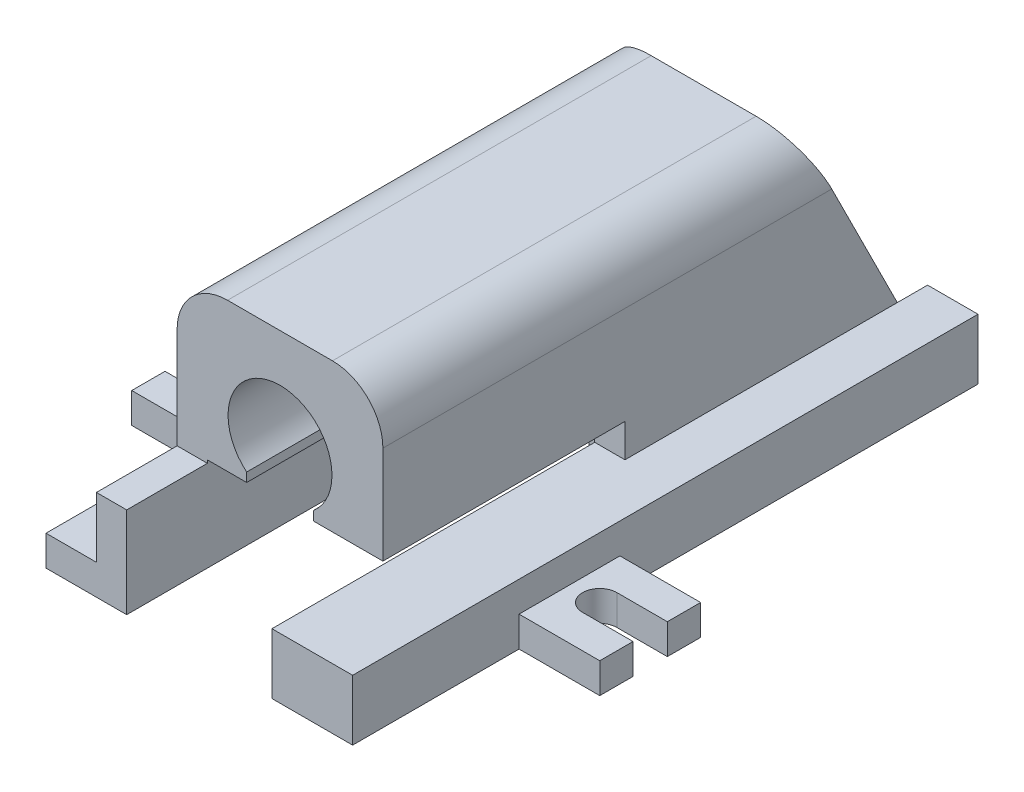
from build123d import *

# Parameters (mm, degrees)
SKETCH1_W           = 4.55
SKETCH1_H           = 21
BOSS_EXTRUDE1_DEPTH = 3
FILLET1_R           = 5
BOSS_EXTRUDE2_DEPTH = 6
SKETCH9_W           = 20.4
SKETCH9_H           = 52
BOSS_EXTRUDE4_DEPTH = 15
CHAMFER4_SIZE       = 20
CHAMFER4_SIZE2      = 10
FILLET5_R           = 5
CUT_EXTRUDE6_DEPTH  = 28
CUT_EXTRUDE7_DEPTH  = 64.484171256
SKETCH16_W          = 32
SKETCH16_H          = 3.3
CUT_EXTRUDE8_DEPTH  = 3
SKETCH17_W          = 5
SKETCH17_H          = 62
BOSS_EXTRUDE5_DEPTH = 3


with BuildPart() as part:
    # Sketch1 → Boss-Extrude1 (new body)
    with BuildSketch(Plane(origin=(0, 0, 0), x_dir=(1, 0, 0), z_dir=(0, 1, 0))):
        with BuildLine():
            Line((-15.2, -14.5), (-15.2, -31))
            Line((-15.2, -31), (-7.2, -31))
            Line((-7.2, -31), (-7.2, 5))
            Line((-7.2, 5), (-7.2, 26))
            Line((-7.2, 26), (-2.65, 26))
            Line((-2.65, 26), (2.65, 26))
            Line((2.65, 26), (7.2, 26))
            Line((7.2, 26), (7.2, 5))
            Line((7.2, 5), (7.2, -31))
            Line((7.2, -31), (15.2, -31))
            Line((15.2, -31), (15.2, -14.5))
            Line((15.2, -14.5), (23.2, -14.5))
            Line((23.2, -14.5), (23.2, -11.2))
            Line((23.2, -11.2), (18.2, -11.2))
            ThreePointArc((18.2, -11.2), (16.5, -9.5), (18.2, -7.8))
            Line((18.2, -7.8), (23.2, -7.8))
            Line((23.2, -7.8), (23.2, -4.5))
            Line((23.2, -4.5), (15.2, -4.5))
            Line((15.2, -4.5), (15.2, 31))
            Line((15.2, 31), (-15.2, 31))
            Line((-15.2, 31), (-15.2, -4.5))
            Line((-15.2, -4.5), (-23.2, -4.5))
            Line((-23.2, -4.5), (-23.2, -7.8))
            Line((-23.2, -7.8), (-18.2, -7.8))
            ThreePointArc((-18.2, -7.8), (-16.5, -9.5), (-18.2, -11.2))
            Line((-18.2, -11.2), (-23.2, -11.2))
            Line((-23.2, -11.2), (-23.2, -14.5))
            Line((-23.2, -14.5), (-15.2, -14.5))
        make_face()
        with Locations((-4.925, 15.5)):
            Rectangle(SKETCH1_W, SKETCH1_H)
        with Locations((4.925, 15.5)):
            Rectangle(SKETCH1_W, SKETCH1_H)
    extrude(amount=BOSS_EXTRUDE1_DEPTH)

    # Fillet1
    fillet1_edges = [part.edges().sort_by_distance(p)[0] for p in [
        (-15.2, 1.5, -31),
    ]]
    fillet(fillet1_edges, radius=FILLET1_R)

    # Sketch3 → Boss-Extrude2 (add)
    with BuildSketch(Plane(origin=(0, 3, 0), x_dir=(1, 0, 0), z_dir=(0, 1, 0))):
        Polygon((10.2, 29), (-10.2, 29), (-10.2, -31), (-7.2, -31), (-7.2, 5), (-2.65, 5), (-2.65, 26), (2.65, 26), (2.65, 5), (7.2, 5), (7.2, -31), (10.2, -31), align=None)
    extrude(amount=BOSS_EXTRUDE2_DEPTH)

    # Sketch9 → Boss-Extrude4 (add)
    with BuildSketch(Plane(origin=(0, 9, 0), x_dir=(1, 0, 0), z_dir=(0, 1, 0))):
        with Locations((0, 3)):
            Rectangle(SKETCH9_W, SKETCH9_H)
    extrude(amount=BOSS_EXTRUDE4_DEPTH)

    # Chamfer4
    chamfer4_edges = [part.edges().sort_by_distance(p)[0] for p in [
        (0, 24, -29),
    ]]
    chamfer4_side = [part.faces().sort_by_distance(p)[0] for p in [
        (0, 13.5, -29),
    ]]
    chamfer(chamfer4_edges, length=CHAMFER4_SIZE, length2=CHAMFER4_SIZE2, reference=chamfer4_side[0])

    # Fillet5
    fillet5_edges = [part.edges().sort_by_distance(p)[0] for p in [
        (10.2, 24, 2),
        (-10.2, 24, 2),
    ]]
    fillet(fillet5_edges, radius=FILLET5_R)

    # Sketch15 → Cut-Extrude6 (cut)
    with BuildSketch(Plane.XY.offset(23)):
        with BuildLine():
            Line((7.2, 9), (7.2, 9.3))
            Line((7.2, 9.3), (3.304542328, 9.3))
            Line((3.304542328, 9.3), (3.304542328, 10.2))
            ThreePointArc((3.304542328, 10.2), (0, 19.3), (-3.304542328, 10.2))
            Line((-3.304542328, 10.2), (-3.304542328, 9.3))
            Line((-3.304542328, 9.3), (-7.2, 9.3))
            Line((-7.2, 9.3), (-7.2, 9))
            Line((-7.2, 9), (7.2, 9))
        make_face()
    extrude(amount=-CUT_EXTRUDE6_DEPTH, mode=Mode.SUBTRACT)

    # Sketch15<6> → Cut-Extrude7 (cut, through all)
    with BuildSketch(Plane.XY.offset(23)):
        with BuildLine():
            ThreePointArc((0, 15.65), (-1.5, 14.15), (0, 12.65))
            Line((0, 12.65), (0, 15.65))
        make_face()
        with BuildLine():
            Line((0, 15.65), (0, 12.65))
            ThreePointArc((0, 12.65), (1.060660172, 13.089339828), (1.5, 14.15))
            ThreePointArc((1.5, 14.15), (1.060660172, 15.210660172), (0, 15.65))
        make_face()
    extrude(amount=-CUT_EXTRUDE7_DEPTH, mode=Mode.SUBTRACT)

    # Sketch16 → Cut-Extrude8 (cut)
    with BuildSketch(Plane(origin=(10.2, 0, 0), x_dir=(0, 0, -1), z_dir=(1, 0, 0))):
        with Locations((-15, 7.65)):
            Rectangle(SKETCH16_W, SKETCH16_H)
    extrude(amount=-CUT_EXTRUDE8_DEPTH, mode=Mode.SUBTRACT)

    # Sketch17 → Boss-Extrude5 (add)
    with BuildSketch(Plane(origin=(0, 3, 0), x_dir=(1, 0, 0), z_dir=(0, 1, 0))):
        with Locations((12.7, 0)):
            Rectangle(SKETCH17_W, SKETCH17_H)
    extrude(amount=BOSS_EXTRUDE5_DEPTH)


solid = part.part
